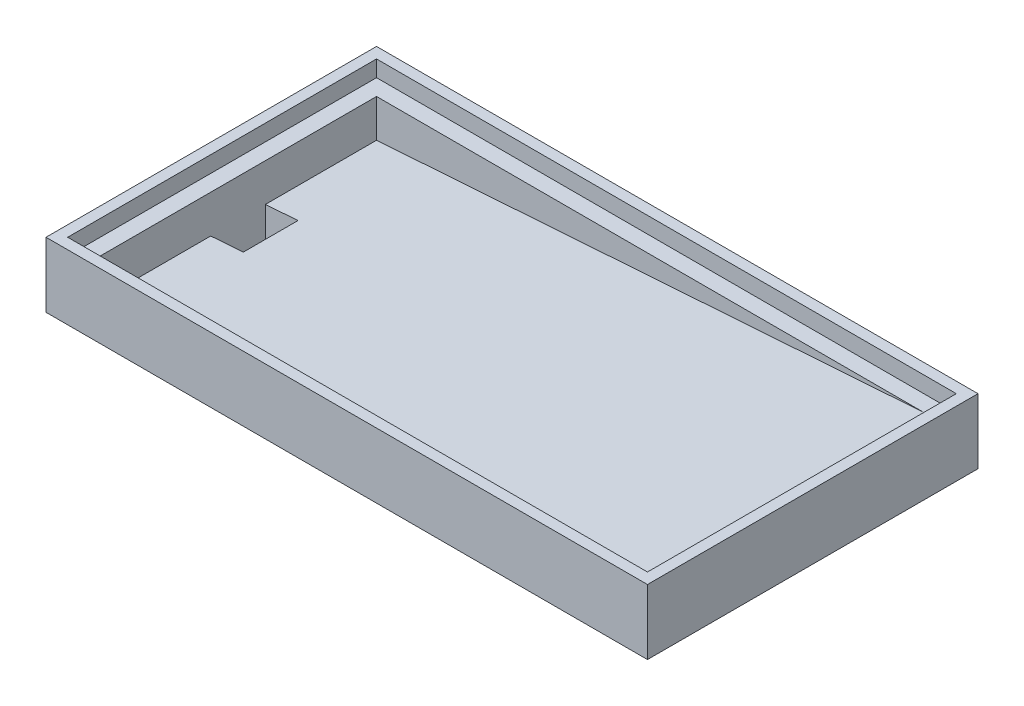
from build123d import *

# Parameters (mm, degrees)
SKETCH_1_W          = 111
SKETCH_1_H          = 61
SKETCH_1_W_2        = 107
SKETCH_1_H_2        = 57
EXTRUDE_1_DEPTH     = 10
SKETCH_3_W          = 111
SKETCH_3_H          = 61
EXTRUDE_1_2_DEPTH   = 2
SKETCH_5_W          = 27.999833333
SKETCH_5_H          = 10.1
EXTRUDE_2_DEPTH     = 8
EXTRUDE_3_REACH     = 127.104
SKETCH_6_W          = 107
SKETCH_6_H          = 57
SKETCH_6_W_2        = 101
SKETCH_6_H_2        = 51
EXTRUDE_4_REACH     = 126.165
SKETCH_8_W          = 6
SKETCH_8_H          = 10.1
CUT_EXTRUDE_1_DEPTH = 10
SKETCH_9_W          = 3
SKETCH_9_H          = 10.1
EXTRUDE_7_DEPTH     = 8


with BuildPart() as part:
    # 草圖1 → Extrude 1 (new body)
    with BuildSketch(Plane(origin=(0, 0, 0), x_dir=(1, 0, 0), z_dir=(0, 1, 0))):
        with Locations((53.5, 28.5)):
            Rectangle(SKETCH_1_W, SKETCH_1_H)
        with Locations((53.5, 28.5)):
            Rectangle(SKETCH_1_W_2, SKETCH_1_H_2, mode=Mode.SUBTRACT)
    extrude(amount=-EXTRUDE_1_DEPTH)

    # 草圖3 → Extrude 1 2 (add)
    with BuildSketch(Plane(origin=(0, -10, 0), x_dir=(-1, 0, 0), z_dir=(0, -1, 0))):
        with Locations((-53.5, 28.5)):
            Rectangle(SKETCH_3_W, SKETCH_3_H)
    extrude(amount=EXTRUDE_1_2_DEPTH)

    # 草圖5 → 填料-伸長2 (add)
    with BuildSketch(Plane.XZ.offset(12)):
        Polygon((-2, -23.5), (-2, -33.5), (-2, -43.5), (37.999833333, -43.5), (37.999833333, -13.5), (-2, -13.5), align=None)
        with Locations((13.999916667, -28.45)):
            Rectangle(SKETCH_5_W, SKETCH_5_H, mode=Mode.SUBTRACT)
    extrude(amount=EXTRUDE_2_DEPTH)

    # 草圖6 → 填料-伸長3 (add, up to next)
    with BuildSketch(Plane(origin=(0, -3, 0), x_dir=(1, 0, 0), z_dir=(0, 1, 0)), mode=Mode.PRIVATE) as extrude_3_sk1:
        with Locations((53.5, 28.5)):
            Rectangle(SKETCH_6_W, SKETCH_6_H)
        with Locations((53.5, 28.5)):
            Rectangle(SKETCH_6_W_2, SKETCH_6_H_2, mode=Mode.SUBTRACT)
    extrude_3_tool1 = extrude(extrude_3_sk1.sketch, amount=-EXTRUDE_3_REACH, mode=Mode.PRIVATE) - part.part
    add(extrude_3_tool1.solids().sort_by_distance((105.787647, -3, -28.5))[0])

    # 草圖7 → 填料-伸長4 (add, up to next)
    with BuildSketch(Plane(origin=(0, 0, -3), x_dir=(-1, 0, 0), z_dir=(0, 0, -1)), mode=Mode.PRIVATE) as extrude_4_sk1:
        Polygon((-104, -3), (-3, -10), (-104, -10), align=None)
    extrude_4_tool1 = extrude(extrude_4_sk1.sketch, amount=EXTRUDE_4_REACH, mode=Mode.PRIVATE) - part.part
    add(extrude_4_tool1.solids().sort_by_distance((70.333333, -7.666667, -3))[0])

    # 草圖8 → 除料-伸長1 (cut)
    with BuildSketch(Plane.XZ.offset(12)):
        with Locations((6, -28.45)):
            Rectangle(SKETCH_8_W, SKETCH_8_H)
    extrude(amount=-CUT_EXTRUDE_1_DEPTH, mode=Mode.SUBTRACT)

    # 草圖9 → 填料-伸長7 (add)
    with BuildSketch(Plane.XZ.offset(12)):
        with Locations((1.5, -28.45)):
            Rectangle(SKETCH_9_W, SKETCH_9_H)
    extrude(amount=EXTRUDE_7_DEPTH)


solid = part.part
